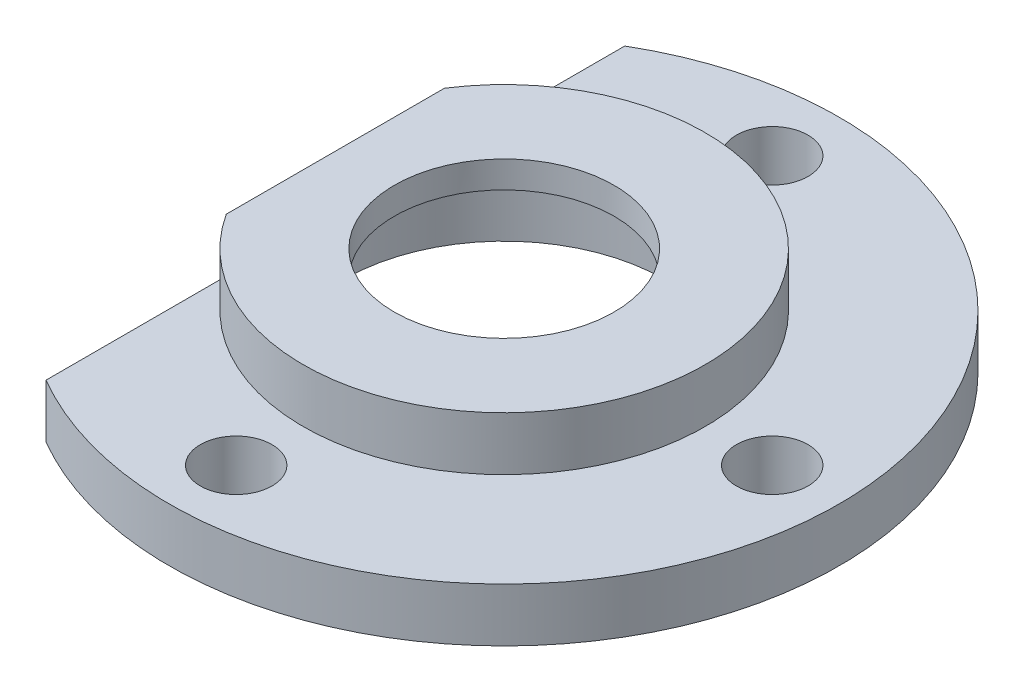
from build123d import *

# Parameters (mm, degrees)
SKETCH1_R                      = 15.875
BOSS_EXTRUDE1_DEPTH            = 2.54
SKETCH2_R                      = 9.525
BOSS_EXTRUDE2_DEPTH            = 2.54
SKETCH3_R                      = 7.62
CUT_EXTRUDE1_DEPTH             = 3.81
CUT_EXTRUDE2_REACH             = 25.018
SKETCH4_R                      = 5.207
CUT_EXTRUDE3_REACH             = 24.594
SKETCH5_R                      = 1.7
CUT_EXTRUDE5_REACH             = 24.594
CUT_EXTRUDE5_DIRECTION_2_DEPTH = 2.794


with BuildPart() as part:
    # Sketch1 → Boss-Extrude1 (new body)
    with BuildSketch(Plane(origin=(0, 0, 0), x_dir=(1, 0, 0), z_dir=(0, 1, 0))):
        with Locations(Location((0, 0, 0), (0, 0, 270))):
            Circle(SKETCH1_R)
    extrude(amount=BOSS_EXTRUDE1_DEPTH)

    # Sketch2 → Boss-Extrude2 (add)
    with BuildSketch(Plane(origin=(0, 2.54, 0), x_dir=(1, 0, 0), z_dir=(0, 1, 0))):
        with Locations(Location((0, 0, 0), (0, 0, 270))):
            Circle(SKETCH2_R)
    extrude(amount=BOSS_EXTRUDE2_DEPTH)

    # Sketch3 → Cut-Extrude1 (cut)
    with BuildSketch(Plane.XZ):
        with Locations(Location((0, 0, 0), (0, 0, 270))):
            Circle(SKETCH3_R)
    extrude(amount=-CUT_EXTRUDE1_DEPTH, mode=Mode.SUBTRACT)

    # Sketch4 → Cut-Extrude2 (cut, up to next)
    with BuildSketch(Plane(origin=(0, 5.08, 0), x_dir=(1, 0, 0), z_dir=(0, 1, 0)), mode=Mode.PRIVATE) as cut_extrude2_sk1:
        with Locations(Location((0, 0, 0), (0, 0, 270))):
            Circle(SKETCH4_R)
    cut_extrude2_tool1 = extrude(cut_extrude2_sk1.sketch, amount=-CUT_EXTRUDE2_REACH, mode=Mode.PRIVATE) & part.part
    add(cut_extrude2_tool1.solids().sort_by_distance((0, 5.08, 0))[0], mode=Mode.SUBTRACT)

    # Sketch5 → Cut-Extrude3 (cut, up to next)
    with BuildSketch(Plane(origin=(0, 2.54, 0), x_dir=(1, 0, 0), z_dir=(0, 1, 0)), mode=Mode.PRIVATE) as cut_extrude3_sk1:
        with Locations(Location((0, 12.7, 0), (0, 0, 270))):
            Circle(SKETCH5_R)
    cut_extrude3_tool1 = extrude(cut_extrude3_sk1.sketch, amount=-CUT_EXTRUDE3_REACH, mode=Mode.PRIVATE) & part.part
    # Sketch5 → Cut-Extrude3 (cut, up to next)
    with BuildSketch(Plane(origin=(0, 2.54, 0), x_dir=(1, 0, 0), z_dir=(0, 1, 0)), mode=Mode.PRIVATE) as cut_extrude3_sk2:
        with Locations(Location((12.7, 0, 0), (0, 0, 270))):
            Circle(SKETCH5_R)
    cut_extrude3_tool2 = extrude(cut_extrude3_sk2.sketch, amount=-CUT_EXTRUDE3_REACH, mode=Mode.PRIVATE) & part.part
    # Sketch5 → Cut-Extrude3 (cut, up to next)
    with BuildSketch(Plane(origin=(0, 2.54, 0), x_dir=(1, 0, 0), z_dir=(0, 1, 0)), mode=Mode.PRIVATE) as cut_extrude3_sk3:
        with Locations(Location((0, -12.7, 0), (0, 0, 270))):
            Circle(SKETCH5_R)
    cut_extrude3_tool3 = extrude(cut_extrude3_sk3.sketch, amount=-CUT_EXTRUDE3_REACH, mode=Mode.PRIVATE) & part.part
    # Sketch5 → Cut-Extrude3 (cut, up to next)
    with BuildSketch(Plane(origin=(0, 2.54, 0), x_dir=(1, 0, 0), z_dir=(0, 1, 0)), mode=Mode.PRIVATE) as cut_extrude3_sk4:
        with Locations(Location((-12.7, 0, 0), (0, 0, 270))):
            Circle(SKETCH5_R)
    cut_extrude3_tool4 = extrude(cut_extrude3_sk4.sketch, amount=-CUT_EXTRUDE3_REACH, mode=Mode.PRIVATE) & part.part
    add(cut_extrude3_tool1.solids().sort_by_distance((0, 2.54, -12.7))[0], mode=Mode.SUBTRACT)
    add(cut_extrude3_tool2.solids().sort_by_distance((12.7, 2.54, 0))[0], mode=Mode.SUBTRACT)
    add(cut_extrude3_tool3.solids().sort_by_distance((0, 2.54, 12.7))[0], mode=Mode.SUBTRACT)
    add(cut_extrude3_tool4.solids().sort_by_distance((-12.7, 2.54, 0))[0], mode=Mode.SUBTRACT)

    # Sketch6 → Cut-Extrude5 (cut, up to next)
    with BuildSketch(Plane(origin=(0, 2.54, 0), x_dir=(1, 0, 0), z_dir=(0, 1, 0)), mode=Mode.PRIVATE) as cut_extrude5_sk1:
        with BuildLine():
            Line((-8, -13.711878974), (-8, 13.711878974))
            ThreePointArc((-8, 13.711878974), (-15.875, 0), (-8, -13.711878974))
        make_face()
    cut_extrude5_tool1 = extrude(cut_extrude5_sk1.sketch, amount=-CUT_EXTRUDE5_REACH, mode=Mode.PRIVATE) & part.part
    add(cut_extrude5_tool1.solids().sort_by_distance((-11.228338, 2.54, 0))[0], mode=Mode.SUBTRACT)

    # Sketch6 → Cut-Extrude5 direction 2 (cut)
    with BuildSketch(Plane(origin=(0, 2.54, 0), x_dir=(1, 0, 0), z_dir=(0, 1, 0))):
        with BuildLine():
            Line((-8, -13.711878974), (-8, 13.711878974))
            ThreePointArc((-8, 13.711878974), (-15.875, 0), (-8, -13.711878974))
        make_face()
    extrude(amount=CUT_EXTRUDE5_DIRECTION_2_DEPTH, mode=Mode.SUBTRACT)


solid = part.part
